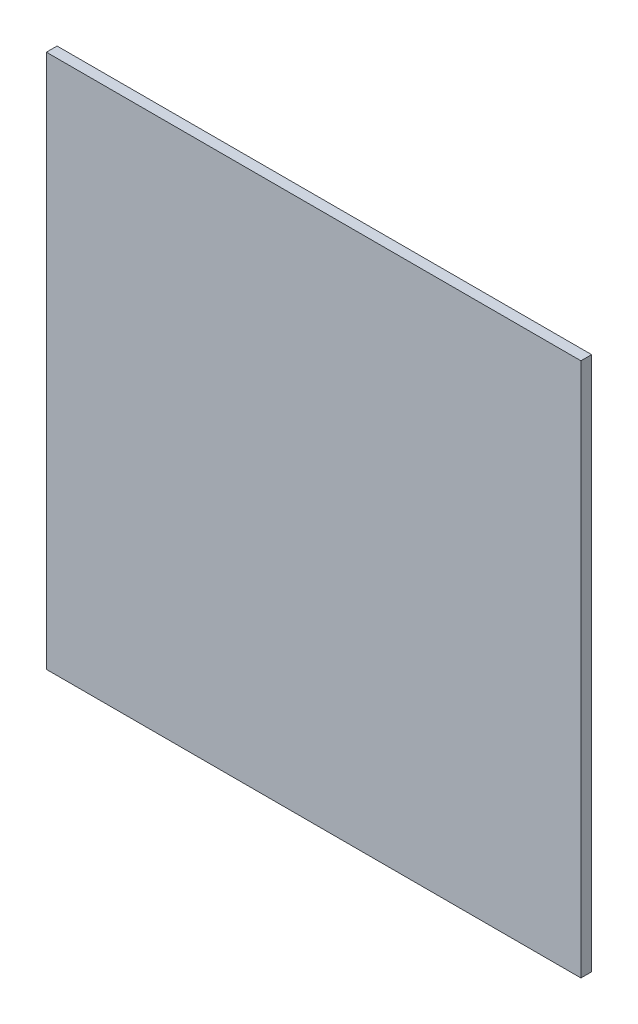
from build123d import *

# Parameters (mm, degrees)
SKETCH_1_W      = 250
SKETCH_1_H      = 250
EXTRUDE_1_DEPTH = 5


with BuildPart() as part:
    # 스케치1 → 보스-돌출1 (new body)
    with BuildSketch(Plane.XY):
        Rectangle(SKETCH_1_W, SKETCH_1_H)
    extrude(amount=EXTRUDE_1_DEPTH)


solid = part.part
